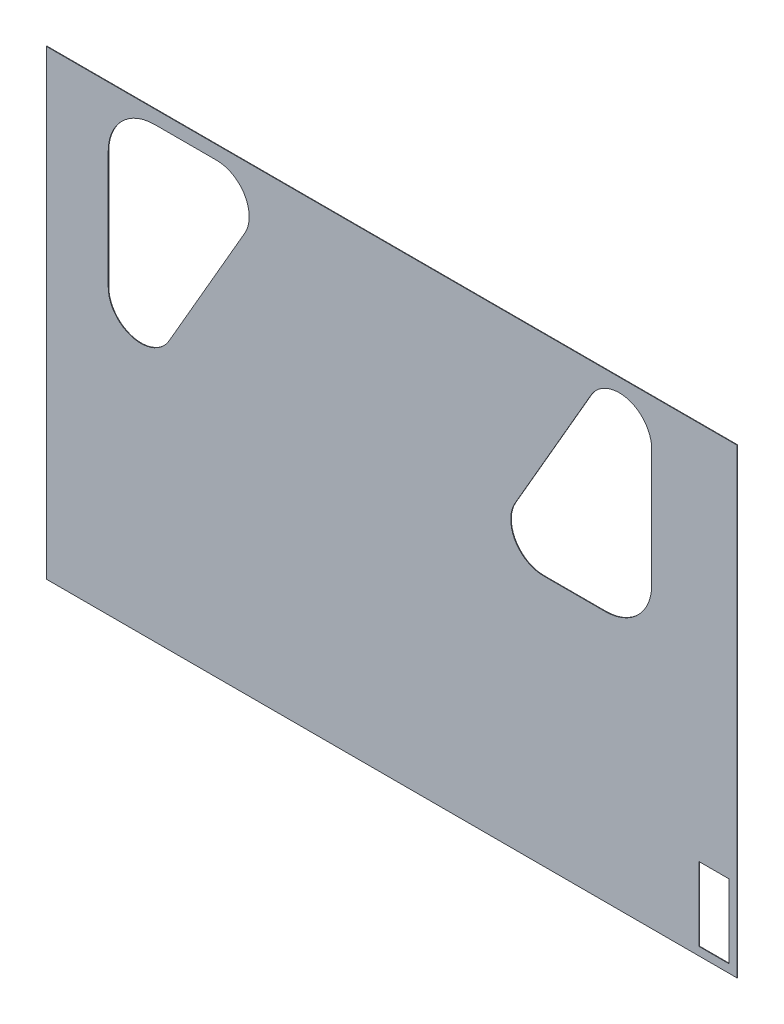
from build123d import *

# Parameters (mm, degrees)
SKETCH1_W           = 2500
SKETCH1_H           = 1670
SKETCH1_W_2         = 108.44
SKETCH1_H_2         = 266
BOSS_EXTRUDE1_DEPTH = 2
CUT_EXTRUDE1_DEPTH  = 2994.515882891


with BuildPart() as part:
    # Sketch1 → Boss-Extrude1 (new body)
    with BuildSketch(Plane.XY):
        with Locations((1250, 835)):
            Rectangle(SKETCH1_W, SKETCH1_H)
        with Locations((2415.78, 163)):
            Rectangle(SKETCH1_W_2, SKETCH1_H_2, mode=Mode.SUBTRACT)
    extrude(amount=BOSS_EXTRUDE1_DEPTH)

    # Sketch2 → Cut-Extrude1 (cut, through all)
    with BuildSketch(Plane(origin=(471.963517843, -531.616762327, 33), x_dir=(1, 0, 0), z_dir=(0, 0, 1))):
        with BuildLine():
            Line((1498.845356152, 2093.616540003), (1224.605356152, 1618.616540003))
            ThreePointArc((1224.605356152, 1618.616540003), (1224.605548691, 1500.616651165), (1326.796482157, 1441.616762327))
            Line((1326.796482157, 1441.616762327), (1551.036482157, 1441.616762327))
            ThreePointArc((1551.036482157, 1441.616762327), (1669.830421397, 1490.822823088), (1719.036482157, 1609.616762327))
            Line((1719.036482157, 1609.616762327), (1719.036482157, 2034.616762327))
            ThreePointArc((1719.036482157, 2034.616762327), (1631.577005494, 2148.596043051), (1498.845356152, 2093.616540003))
        make_face()
        with BuildLine():
            Line((-247.963517843, 1984.616762327), (-247.963517843, 1559.616762327))
            ThreePointArc((-247.963517843, 1559.616762327), (-160.504041179, 1445.637481603), (-27.772391837, 1500.616984652))
            Line((-27.772391837, 1500.616984652), (246.467608163, 1975.616984652))
            ThreePointArc((246.467608163, 1975.616984652), (246.467415624, 2093.61687349), (144.276482157, 2152.616762327))
            Line((144.276482157, 2152.616762327), (-79.963517843, 2152.616762327))
            ThreePointArc((-79.963517843, 2152.616762327), (-198.757457082, 2103.410701567), (-247.963517843, 1984.616762327))
        make_face()
    extrude(amount=-CUT_EXTRUDE1_DEPTH, mode=Mode.SUBTRACT)


solid = part.part
